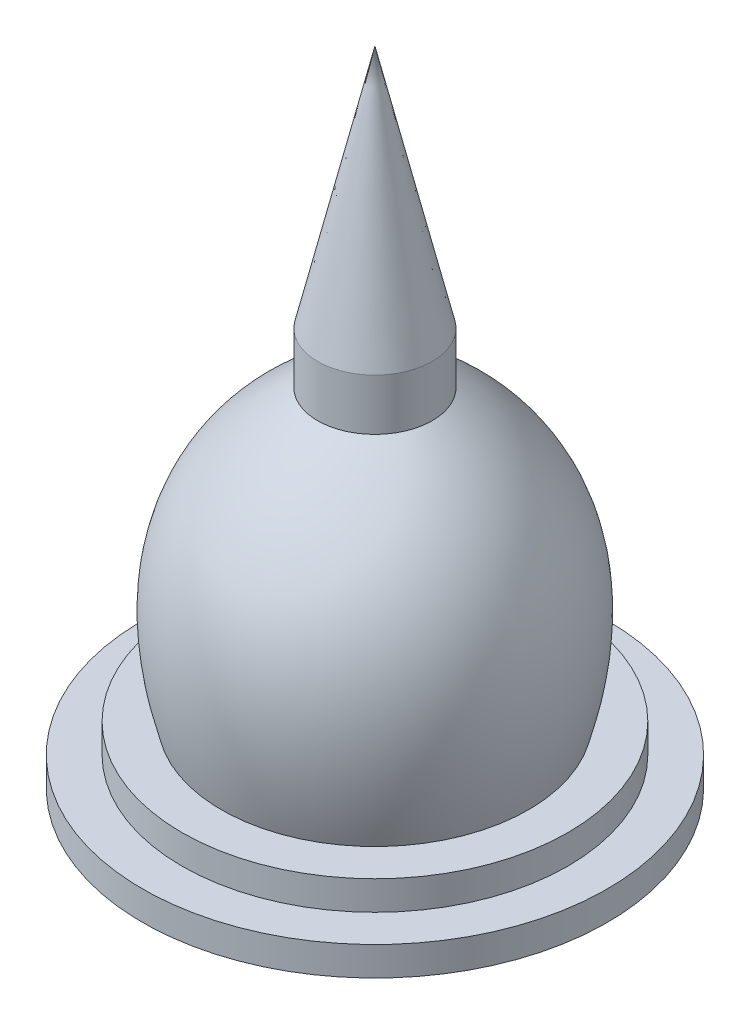
from build123d import *

# Parameters (mm, degrees)
SCALE1_SCALE = 3


with BuildPart() as part:
    # Sketch1 → Revolve1 (revolve)
    with BuildSketch(Plane.XY, mode=Mode.PRIVATE) as revolve1_sk:
        with BuildLine():
            Line((-60, 0), (0, 0))
            Line((0, 0), (0, 165.974487707))
            Line((0, 165.974487707), (-14.807816841, 102.857120804))
            Line((-14.807816841, 102.857120804), (-14.807816841, 89.595445726))
            add(Edge.make_bspline(
                [(-39.636500765, 15.003432323), (-53.842680806, 64.800607808), (-14.807816841, 89.595445726)],
                knots=[0, 0, 0, 1, 1, 1], degree=2))
            Line((-39.636500765, 15.003432323), (-49.818250415, 15.003432323))
            Line((-49.818250415, 15.003432323), (-49.818250415, 7.502288215))
            Line((-49.818250415, 7.502288215), (-60, 7.501144108))
            Line((-60, 7.501144108), (-60, 0))
        make_face()
    revolve(revolve1_sk.sketch.rotate(Axis((0, 0, 0), (0, 1, 0)), 270), axis=Axis((0, 0, 0), (0, 1, 0)))


with BuildPart() as part_1:
    # Scale1: scaled about (0, 38.251472445, 0)
    add(part.part.scale(SCALE1_SCALE).moved(Location((0, -76.50294489, 0))))


solid = part_1.part
